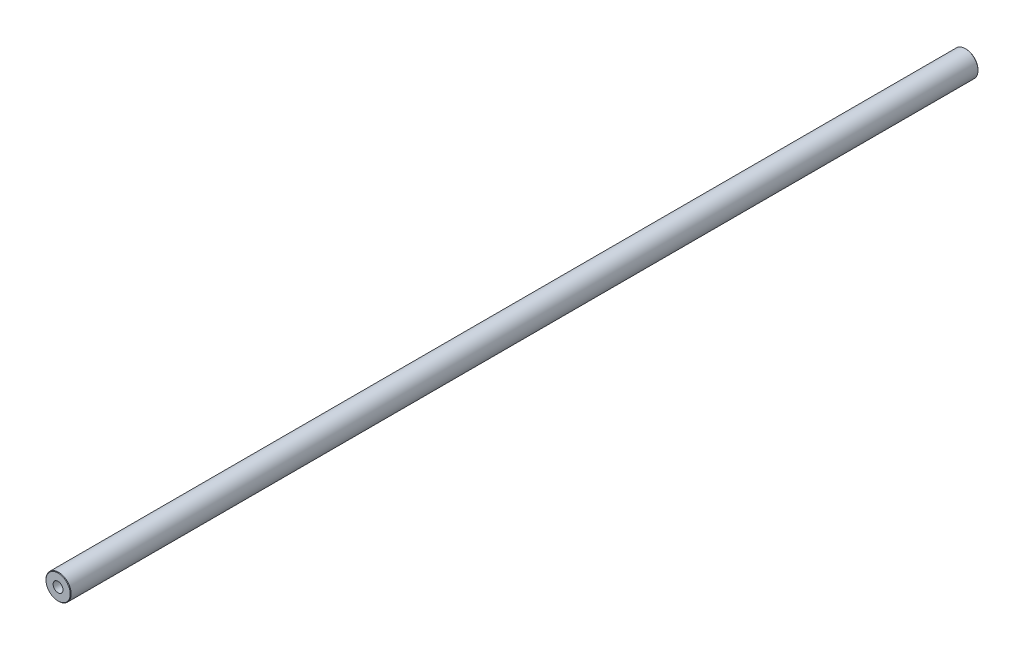
from build123d import *

# Parameters (mm, degrees)
BOSS_EXTRUDE1_DEPTH                 = 228.6
BOSS_EXTRUDE1_DEPTH_BACK            = 228.6
SKETCH3_R                           = 6.35
CHAMFER1_SIZE                       = 0.254
M6X1_0_TAPPED_HOLE1_D               = 5
M6X1_0_TAPPED_HOLE1_DEPTH           = 25
M6X1_0_TAPPED_HOLE1_TIP             = 1.502151548
M6X1_0_TAPPED_HOLE1_ON_FACE_2_D     = 5
M6X1_0_TAPPED_HOLE1_ON_FACE_2_DEPTH = 25
M6X1_0_TAPPED_HOLE1_ON_FACE_2_TIP   = 1.502151548


with BuildPart() as part:
    # Sketch3 → Boss-Extrude1 (new, two sides: drawn at the far end of the back side and taken through both)
    with BuildSketch(Plane.XY.offset(-BOSS_EXTRUDE1_DEPTH_BACK)):
        Circle(SKETCH3_R)
    extrude(amount=BOSS_EXTRUDE1_DEPTH + BOSS_EXTRUDE1_DEPTH_BACK)

    # Chamfer1
    chamfer1_edges = [part.edges().sort_by_distance(p)[0] for p in [
        (-6.35, 0, -228.6),
        (-6.35, 0, 228.6),
    ]]
    chamfer(chamfer1_edges, length=CHAMFER1_SIZE)

    # M6x1.0 Tapped Hole1
    with Locations(Plane(origin=(0, 0, -228.6), x_dir=(-1, 0, 0), z_dir=(0, 0, -1))):
        with Locations((0, 0)):
            Hole(M6X1_0_TAPPED_HOLE1_D / 2, depth=M6X1_0_TAPPED_HOLE1_DEPTH)
            with Locations((0, 0, -(M6X1_0_TAPPED_HOLE1_DEPTH + M6X1_0_TAPPED_HOLE1_TIP / 2))):  # 118° drill point
                Cone(0, M6X1_0_TAPPED_HOLE1_D / 2, M6X1_0_TAPPED_HOLE1_TIP, mode=Mode.SUBTRACT)

    # M6x1.0 Tapped Hole1 on face 2
    with Locations(Plane.XY.offset(228.6)):
        with Locations((0, 0)):
            Hole(M6X1_0_TAPPED_HOLE1_ON_FACE_2_D / 2, depth=M6X1_0_TAPPED_HOLE1_ON_FACE_2_DEPTH)
            with Locations((0, 0, -(M6X1_0_TAPPED_HOLE1_ON_FACE_2_DEPTH + M6X1_0_TAPPED_HOLE1_ON_FACE_2_TIP / 2))):  # 118° drill point
                Cone(0, M6X1_0_TAPPED_HOLE1_ON_FACE_2_D / 2, M6X1_0_TAPPED_HOLE1_ON_FACE_2_TIP, mode=Mode.SUBTRACT)


solid = part.part
